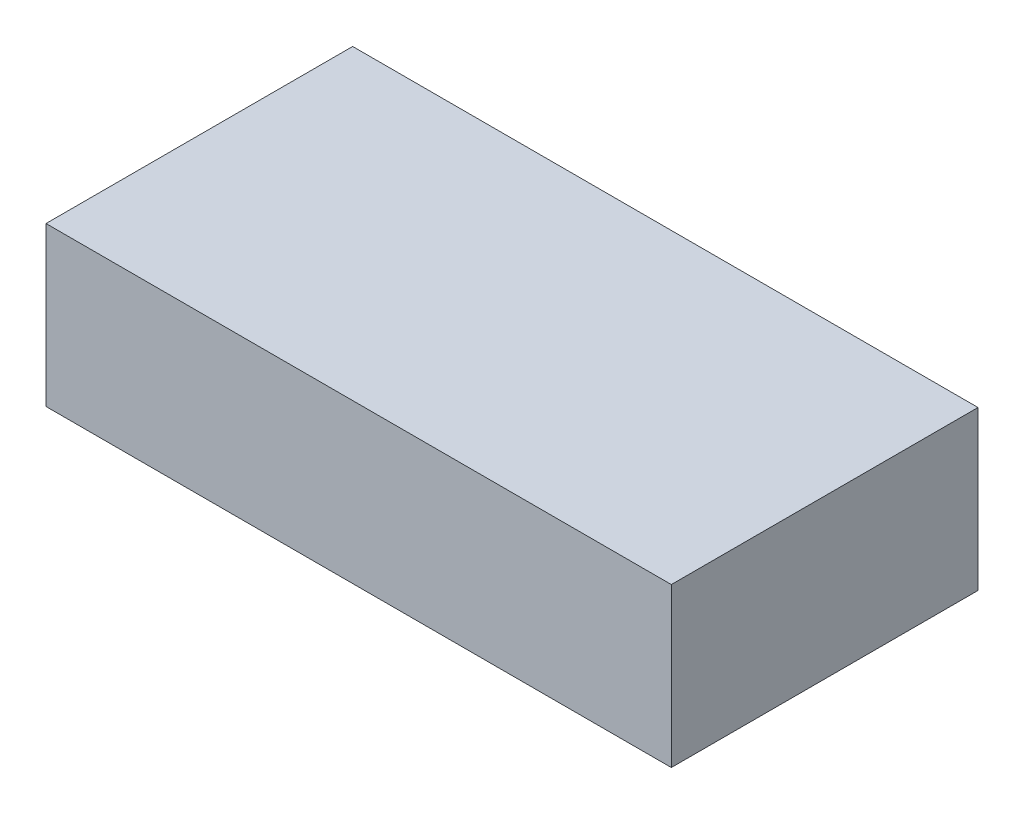
from build123d import *

# Parameters (mm, degrees)
SKETCH2_W           = 118.368825978
SKETCH2_H           = 58.048677986
BOSS_EXTRUDE1_DEPTH = 30


with BuildPart() as part:
    # Sketch2 → Boss-Extrude1 (new body)
    with BuildSketch(Plane(origin=(0, 0, 0), x_dir=(1, 0, 0), z_dir=(0, 1, 0))):
        Rectangle(SKETCH2_W, SKETCH2_H)
    extrude(amount=BOSS_EXTRUDE1_DEPTH)


solid = part.part
